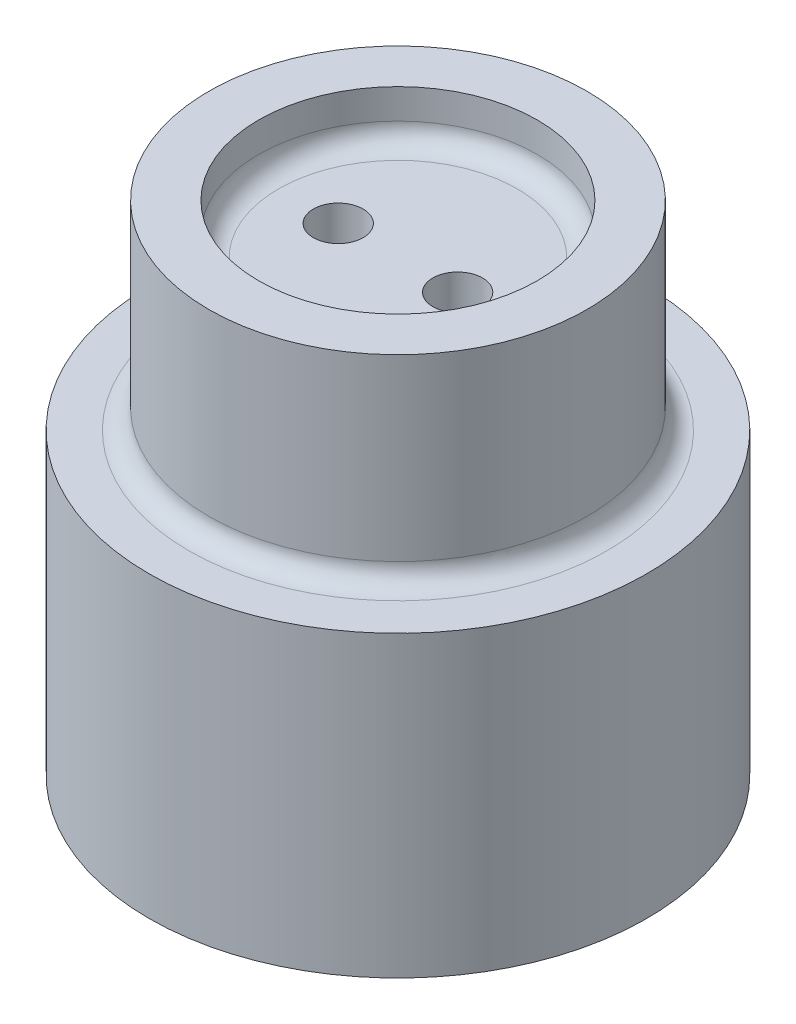
from build123d import *

# Parameters (mm, degrees)
BOSS_EXTRUDE1_START = -7.62
SKETCH2_R           = 35.56
BOSS_EXTRUDE1_DEPTH = 7.62
SKETCH4_R           = 8.89
SKETCH4_R_2         = 6.35
CUT_EXTRUDE1_REACH  = 157.543
SKETCH7_R           = 6.35
CUT_EXTRUDE2_REACH  = 147.358
SKETCH8_R           = 6.35
FILLET1_R           = 5.08


with BuildPart() as part:
    # Sketch1 → Revolve2 (revolve)
    with BuildSketch(Plane.XY, mode=Mode.PRIVATE) as revolve2_sk:
        Polygon((0, 0), (63.5, 0), (63.5, 76.2), (48.26, 76.2), (48.26, 127), (35.56, 127), (35.56, 63.5), (50.8, 63.5), (50.8, 12.7), (0, 12.7), align=None)
    revolve(revolve2_sk.sketch.rotate(Axis((0, 12.7, 0), (0, -1, 0)), 90), axis=Axis((0, 12.7, 0), (0, -1, 0)))

    # Sketch2 → Boss-Extrude1 (add)
    with BuildSketch(Plane(origin=(0, 114.3, 0), x_dir=(1, 0, 0), z_dir=(0, 1, 0)).offset(BOSS_EXTRUDE1_START)):
        with Locations(Location((0, 0, 0), (0, 0, 270))):
            Circle(SKETCH2_R)
    extrude(amount=BOSS_EXTRUDE1_DEPTH)

    # Sweep1: sweep along a path in Sketch5
    with BuildLine(Plane.XY) as sweep1_path:
        Line((15.24, 114.3), (15.24, 50.8))
        Line((15.24, 50.8), (33.02, 50.8))
        Line((33.02, 50.8), (33.02, 0))
    # Sketch4 → Sweep1 (sweep)
    with BuildSketch(Plane(origin=(0, 114.3, 0), x_dir=(1, 0, 0), z_dir=(0, 1, 0))):
        with Locations((15.24, 0)):
            Circle(SKETCH4_R)
        with Locations((15.24, 0)):
            Circle(SKETCH4_R_2, mode=Mode.SUBTRACT)
    sweep1 = sweep(path=sweep1_path.line, transition=Transition.RIGHT)

    # Sketch7 → Cut-Extrude1 (cut, up to next)
    with BuildSketch(Plane.XZ, mode=Mode.PRIVATE) as cut_extrude1_sk1:
        with Locations(Location((33.02, 0, 0), (0, 0, 270))):
            Circle(SKETCH7_R)
    cut_extrude1_tool1 = extrude(cut_extrude1_sk1.sketch, amount=-CUT_EXTRUDE1_REACH, mode=Mode.PRIVATE) & part.part
    cut_extrude1 = cut_extrude1_tool1.solids().sort_by_distance((33.02, 0, 0))[0]
    add(cut_extrude1, mode=Mode.SUBTRACT)

    # Sketch8 → Cut-Extrude2 (cut, up to next)
    with BuildSketch(Plane(origin=(0, 114.3, 0), x_dir=(1, 0, 0), z_dir=(0, 1, 0)), mode=Mode.PRIVATE) as cut_extrude2_sk1:
        with Locations(Location((15.24, 0, 0), (0, 0, 270))):
            Circle(SKETCH8_R)
    cut_extrude2_tool1 = extrude(cut_extrude2_sk1.sketch, amount=-CUT_EXTRUDE2_REACH, mode=Mode.PRIVATE) & part.part
    cut_extrude2 = cut_extrude2_tool1.solids().sort_by_distance((15.24, 114.3, 0))[0]
    add(cut_extrude2, mode=Mode.SUBTRACT)

    # Mirror1: Sweep1, Cut-Extrude1, Cut-Extrude2 across plane
    add(sweep1.mirror(Plane(origin=(0, 0, 0), x_dir=(0, 0, 1), z_dir=(1, 0, 0))))
    add(cut_extrude1.mirror(Plane(origin=(0, 0, 0), x_dir=(0, 0, 1), z_dir=(1, 0, 0))), mode=Mode.SUBTRACT)
    add(cut_extrude2.mirror(Plane(origin=(0, 0, 0), x_dir=(0, 0, 1), z_dir=(1, 0, 0))), mode=Mode.SUBTRACT)

    # Fillet1
    fillet1_edges = [part.edges().sort_by_distance(p)[0] for p in [
        (0, 76.2, -48.26),
        (0, 114.3, -35.56),
    ]]
    fillet(fillet1_edges, radius=FILLET1_R)


solid = part.part
